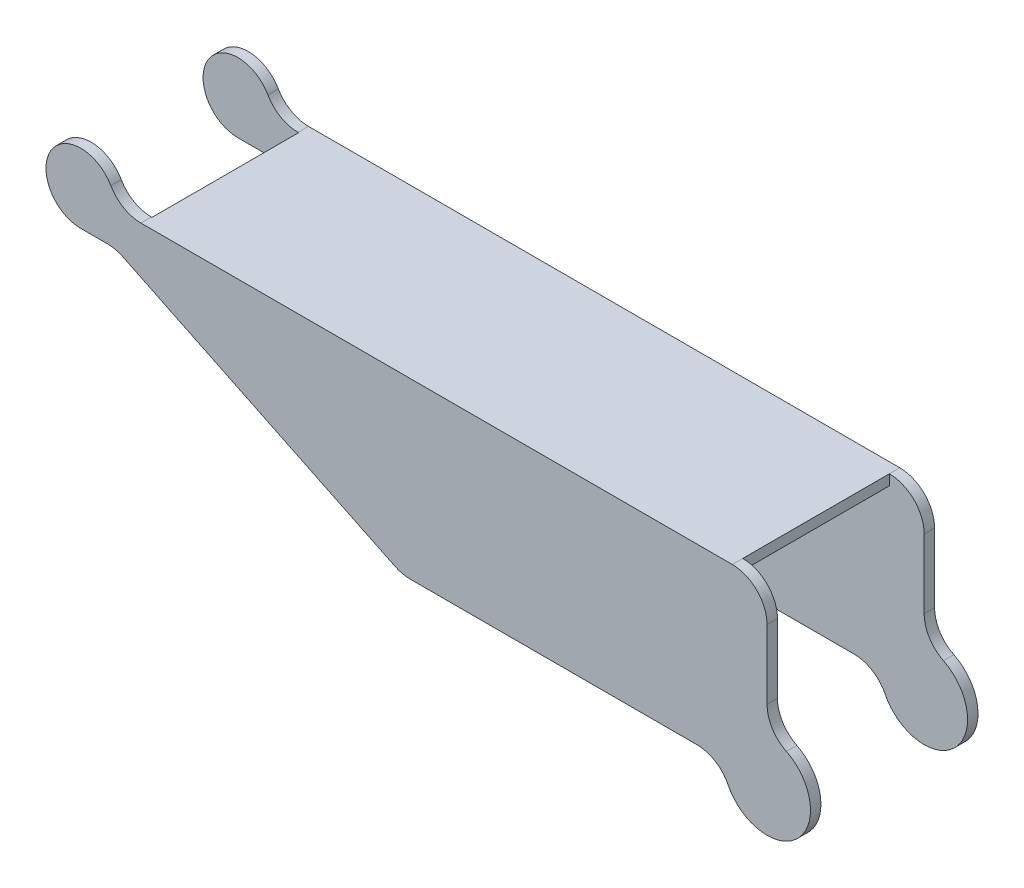
from build123d import *

# Parameters (mm, degrees)
SALIENTE_EXTRUIR1_DEPTH = 3
CROQUIS2_W              = 170
CROQUIS2_H              = 48.2
SALIENTE_EXTRUIR2_DEPTH = 3


with BuildPart() as part:
    # Croquis1 → Saliente-Extruir1 (new body)
    with BuildSketch(Plane.XY):
        with BuildLine():
            Line((-98.745, 15), (-91.041526265, 15))
            ThreePointArc((-91.041526265, 15), (-88.803264961, 14.746290901), (-86.678577108, 13.998037267))
            Line((-86.678577108, 13.998037267), (-8.316422892, -23.998037267))
            ThreePointArc((-8.316422892, -23.998037267), (-6.191735039, -24.746290901), (-3.953473735, -25))
            Line((-3.953473735, -25), (78.589355629, -25))
            ThreePointArc((78.589355629, -25), (83.859818396, -26.501634144), (87.547419794, -30.555555556))
            ThreePointArc((87.547419794, -30.555555556), (107.583834765, -33.838834765), (104.300555556, -13.802419794))
            ThreePointArc((104.300555556, -13.802419794), (100.246634144, -10.114818396), (98.745, -4.844355629))
            Line((98.745, -4.844355629), (98.745, 15))
            ThreePointArc((98.745, 15), (95.816067812, 22.071067812), (88.745, 25))
            Line((88.745, 25), (-81.424491924, 25))
            ThreePointArc((-81.424491924, 25), (-86.424491924, 26.339745962), (-90.084745962, 30))
            ThreePointArc((-90.084745962, 30), (-107.405254038, 30), (-98.745, 15))
        make_face()
    extrude(amount=SALIENTE_EXTRUIR1_DEPTH)


with BuildPart() as body_2:
    # Simetría2: mirrored copy
    add(part.part.mirror(Plane.XY.offset(-21.1)))


with BuildPart() as part_1:
    add(part.part)

    add(body_2.part)  # Saliente-Extruir2 merges body 2
    # Croquis2 → Saliente-Extruir2 (add)
    with BuildSketch(Plane(origin=(0, 25, 0), x_dir=(1, 0, 0), z_dir=(0, 1, 0))):
        with Locations((3.745, 21.1)):
            Rectangle(CROQUIS2_W, CROQUIS2_H)
    extrude(amount=-SALIENTE_EXTRUIR2_DEPTH)


solid = part_1.part
